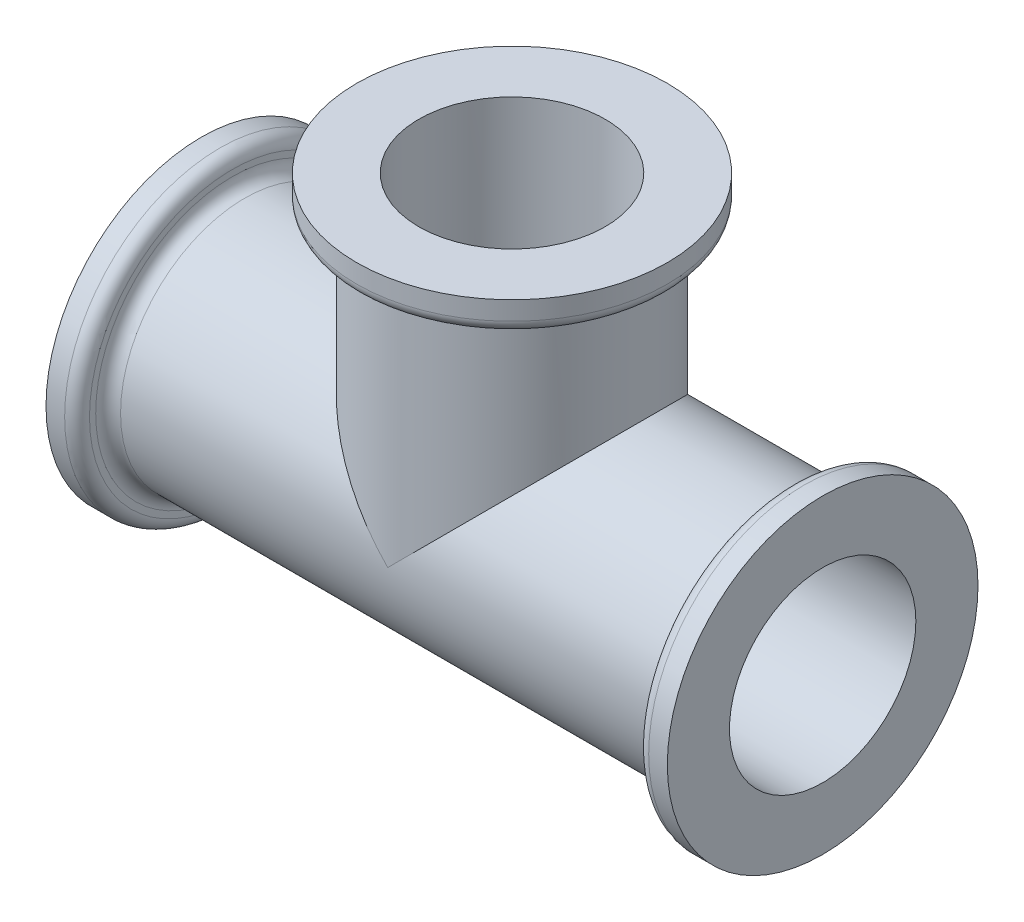
from build123d import *

# Parameters (mm, degrees)
SKETCH2_R                = 10
SKETCH2_R_2              = 7.5
SKETCH3_R                = 12.5
SKETCH3_R_2              = 7.5
BOSS_EXTRUDE1_DEPTH      = 2.5
BOSS_EXTRUDE2_DEPTH      = 15
BOSS_EXTRUDE2_DEPTH_BACK = 7.5
SKETCH4_R                = 10
SKETCH4_R_2              = 7.5
SKETCH5_R                = 7.5
CUT_EXTRUDE1_DEPTH       = 57.236109525
CUT_EXTRUDE2_REACH       = 46.791
SKETCH6_R                = 7.5
SKETCH7_R                = 12.5
SKETCH7_R_2              = 7.5
BOSS_EXTRUDE3_DEPTH      = 2.5
FILLET1_R                = 1


with BuildPart() as part:
    # Sweep-Thin1: sweep along a path in Sketch1
    with BuildLine(Plane.XY) as sweep_thin1_path:
        Line((-25, 0), (0, 0))
        Line((0, 0), (25, 0))
    # Sketch2 → Sweep-Thin1 (sweep)
    with BuildSketch(Plane(origin=(0, 0, 0), x_dir=(0, 0, -1), z_dir=(1, 0, 0))):
        Circle(SKETCH2_R)
        Circle(SKETCH2_R_2, mode=Mode.SUBTRACT)
    sweep(path=sweep_thin1_path.line)

    # Sketch3 → Boss-Extrude1 (add)
    with BuildSketch(Plane(origin=(25, 0, 0), x_dir=(0, 0, -1), z_dir=(1, 0, 0))):
        Circle(SKETCH3_R)
        Circle(SKETCH3_R_2, mode=Mode.SUBTRACT)
    extrude(amount=-BOSS_EXTRUDE1_DEPTH)

    # Mirror1: part across plane


with BuildPart() as part_1:
    add(part.part)
    add(part.part.mirror(Plane(origin=(0, 0, 0), x_dir=(0, 0, 1), z_dir=(1, 0, 0))))

    # Sketch4 → Boss-Extrude2 (add, two sides: drawn at the far end of the back side and taken through both)
    with BuildSketch(Plane(origin=(0, 7.5, 0), x_dir=(1, 0, 0), z_dir=(0, 1, 0)).offset(-BOSS_EXTRUDE2_DEPTH_BACK)):
        with Locations(Location((0, 0, 0), (0, 0, 270))):
            Circle(SKETCH4_R)
        with Locations(Location((0, 0, 0), (0, 0, 270))):
            Circle(SKETCH4_R_2, mode=Mode.SUBTRACT)
    extrude(amount=BOSS_EXTRUDE2_DEPTH + BOSS_EXTRUDE2_DEPTH_BACK)

    # Sketch5 → Cut-Extrude1 (cut, through all)
    with BuildSketch(Plane(origin=(25, 0, 0), x_dir=(0, 0, -1), z_dir=(1, 0, 0))):
        Circle(SKETCH5_R)
    extrude(amount=-CUT_EXTRUDE1_DEPTH, mode=Mode.SUBTRACT)

    # Sketch6 → Cut-Extrude2 (cut, up to next)
    with BuildSketch(Plane(origin=(0, 22.5, 0), x_dir=(1, 0, 0), z_dir=(0, 1, 0)), mode=Mode.PRIVATE) as cut_extrude2_sk1:
        with Locations(Location((0, 0, 0), (0, 0, 270))):
            Circle(SKETCH6_R)
    cut_extrude2_tool1 = extrude(cut_extrude2_sk1.sketch, amount=-CUT_EXTRUDE2_REACH, mode=Mode.PRIVATE) & part_1.part
    add(cut_extrude2_tool1.solids().sort_by_distance((0, 22.5, 0))[0], mode=Mode.SUBTRACT)

    # Sketch7 → Boss-Extrude3 (add)
    with BuildSketch(Plane(origin=(0, 22.5, 0), x_dir=(1, 0, 0), z_dir=(0, 1, 0))):
        with Locations(Location((0, 0, 0), (0, 0, 270))):
            Circle(SKETCH7_R)
        with Locations(Location((0, 0, 0), (0, 0, 270))):
            Circle(SKETCH7_R_2, mode=Mode.SUBTRACT)
    extrude(amount=-BOSS_EXTRUDE3_DEPTH)

    # Fillet1
    fillet1_edges = [part_1.edges().sort_by_distance(p)[0] for p in [
        (22.5, 0, 10),
        (22.5, 0, 12.5),
        (-22.5, 0, 10),
        (-22.5, 0, 12.5),
        (0, 20, -10),
        (0, 20, -12.5),
    ]]
    fillet(fillet1_edges, radius=FILLET1_R)


solid = part_1.part
